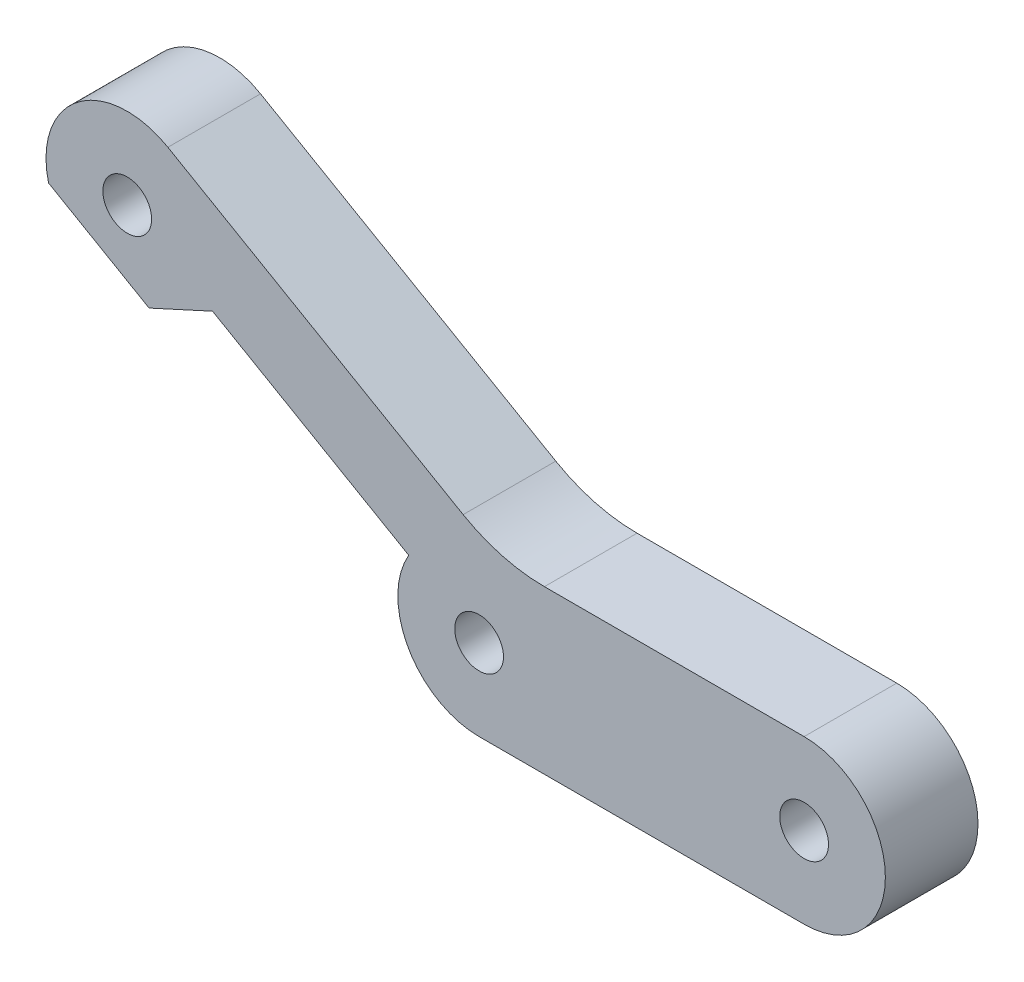
from build123d import *

# Parameters (mm, degrees)
SKETCH_1_R      = 1.5
EXTRUDE_1_DEPTH = 5.7


with BuildPart() as part:
    # 스케치1 → 보스-돌출1 (new body)
    with BuildSketch(Plane.XY):
        with BuildLine():
            Line((-5.980762114, 5), (10, 5))
            ThreePointArc((10, 5), (15, 0), (10, -5))
            Line((10, -5), (-10, -5))
            ThreePointArc((-10, -5), (-14.330127019, -2.5), (-14.330127019, 2.5))
            Line((-14.330127019, 2.5), (-26.400635095, 9.468911087))
            Line((-26.400635095, 9.468911087), (-30.308305875, 7.68355398))
            Line((-30.308305875, 7.68355398), (-33.400635095, 9.468911087))
            Line((-33.400635095, 9.468911087), (-36.492964314, 11.254268194))
            ThreePointArc((-36.492964314, 11.254268194), (-34.674569114, 16.481937097), (-29.150635095, 16.830127019))
            Line((-29.150635095, 16.830127019), (-10.980762114, 6.339745962))
            ThreePointArc((-10.980762114, 6.339745962), (-8.568952565, 5.340741737), (-5.980762114, 5))
        make_face()
        with Locations((-10, 0)):
            Circle(SKETCH_1_R, mode=Mode.SUBTRACT)
        with Locations((10, 0)):
            Circle(SKETCH_1_R, mode=Mode.SUBTRACT)
        with Locations((-31.650635095, 12.5)):
            Circle(SKETCH_1_R, mode=Mode.SUBTRACT)
    extrude(amount=EXTRUDE_1_DEPTH)


solid = part.part
